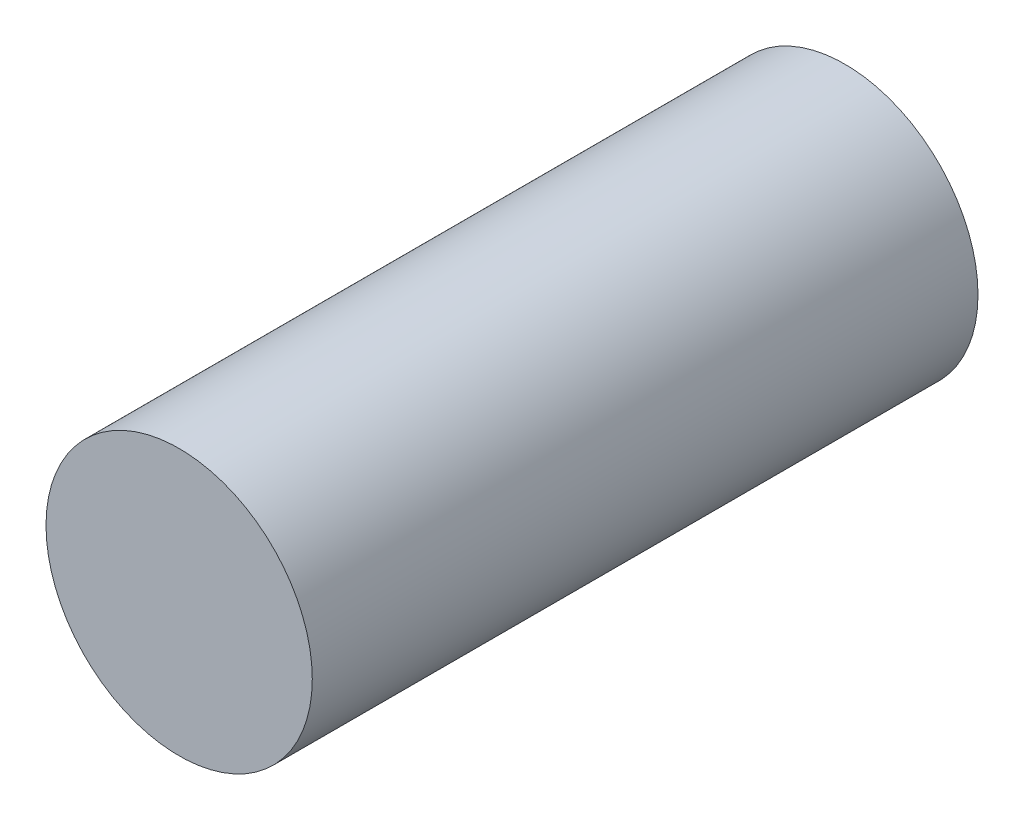
from build123d import *

# Parameters (mm, degrees)
TOPPING_KAT3_KAPAK_PIMI_D8_2_START = -40
SKETCH1_R                          = 4
TOPPING_KAT3_KAPAK_PIMI_D8_2_DEPTH = 20


with BuildPart() as part:
    # Sketch1 → TOPPING_kat3_kapak_pimi_D8_2 (new body)
    with BuildSketch(Plane.XY.offset(TOPPING_KAT3_KAPAK_PIMI_D8_2_START)):
        with Locations((460, 924)):
            Circle(SKETCH1_R)
    extrude(amount=-TOPPING_KAT3_KAPAK_PIMI_D8_2_DEPTH)


solid = part.part
